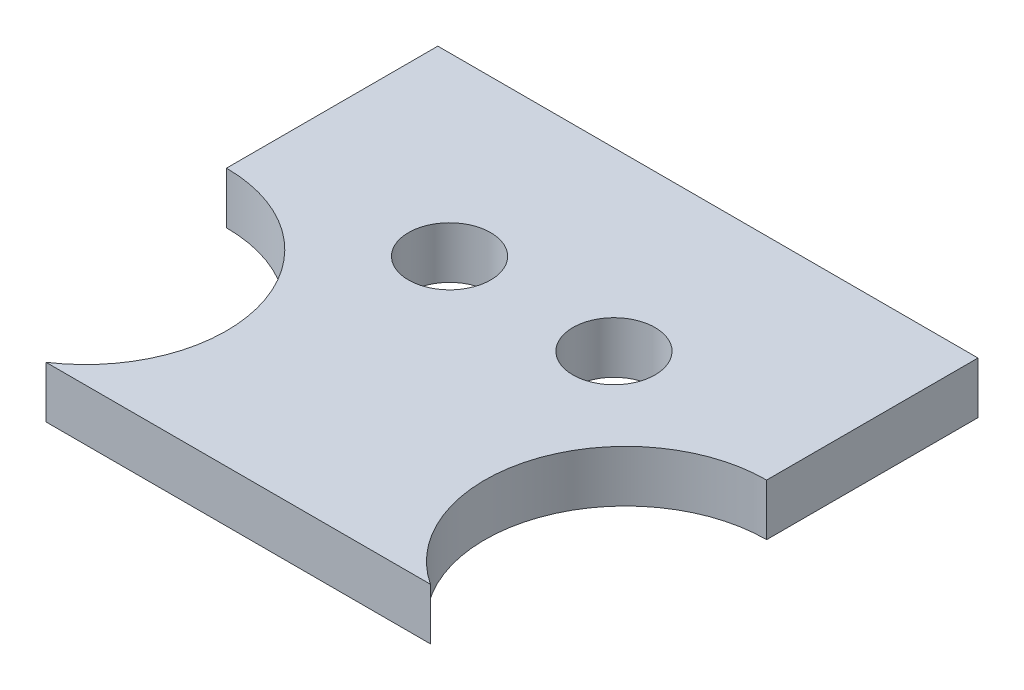
from build123d import *

# Parameters (mm, degrees)
SKETCH1_R           = 3.5
BOSS_EXTRUDE1_DEPTH = 4.4


with BuildPart() as part:
    # Sketch1 → Boss-Extrude1 (new body)
    with BuildSketch(Plane(origin=(0, 0, 0), x_dir=(1, 0, 0), z_dir=(0, 1, 0))):
        with BuildLine():
            Line((-23, 15), (23, 15))
            Line((23, 15), (23, -3))
            ThreePointArc((23, -3), (14.514718626, -6.514718626), (11, -15))
            ThreePointArc((11, -15), (12.426471853, -20.674548662), (16.366750419, -25))
            Line((16.366750419, -25), (-16.366750419, -25))
            ThreePointArc((-16.366750419, -25), (-12.426471853, -20.674548662), (-11, -15))
            ThreePointArc((-11, -15), (-14.514718626, -6.514718626), (-23, -3))
            Line((-23, -3), (-23, 15))
        make_face()
        with Locations(Location((-7, 0, 0), (0, 0, 270))):
            Circle(SKETCH1_R, mode=Mode.SUBTRACT)
        with Locations(Location((7, 0, 0), (0, 0, 270))):
            Circle(SKETCH1_R, mode=Mode.SUBTRACT)
    extrude(amount=BOSS_EXTRUDE1_DEPTH)


solid = part.part
